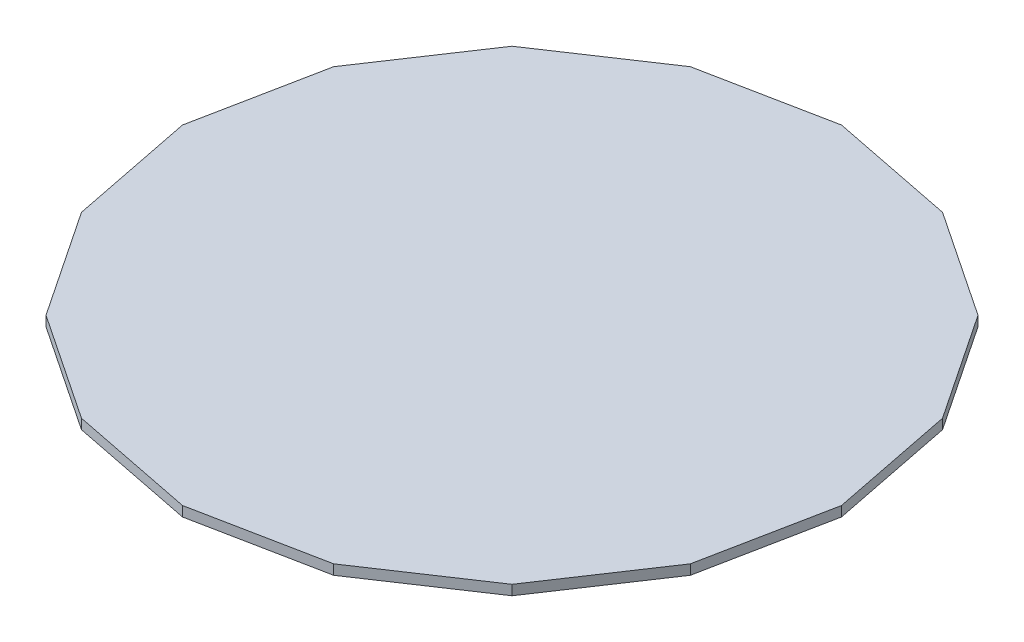
from build123d import *

# Parameters (mm, degrees)
BOSS_EXTRUDE1_DEPTH = 2


with BuildPart() as part:
    # Sketch1 → Boss-Extrude1 (new body)
    with BuildSketch(Plane(origin=(0, 0, 0), x_dir=(1, 0, 0), z_dir=(0, 1, 0))):
        Polygon((66.273425284, 0), (61.228661169, 25.361741862), (46.86238843, 46.86238843), (25.361741862, 61.228661169), (0, 66.273425284), (-25.361741862, 61.228661169), (-46.86238843, 46.86238843), (-61.228661169, 25.361741862), (-66.273425284, 0), (-61.228661169, -25.361741862), (-46.86238843, -46.86238843), (-25.361741862, -61.228661169), (0, -66.273425284), (25.361741862, -61.228661169), (46.86238843, -46.86238843), (61.228661169, -25.361741862), align=None)
    extrude(amount=BOSS_EXTRUDE1_DEPTH)


solid = part.part
